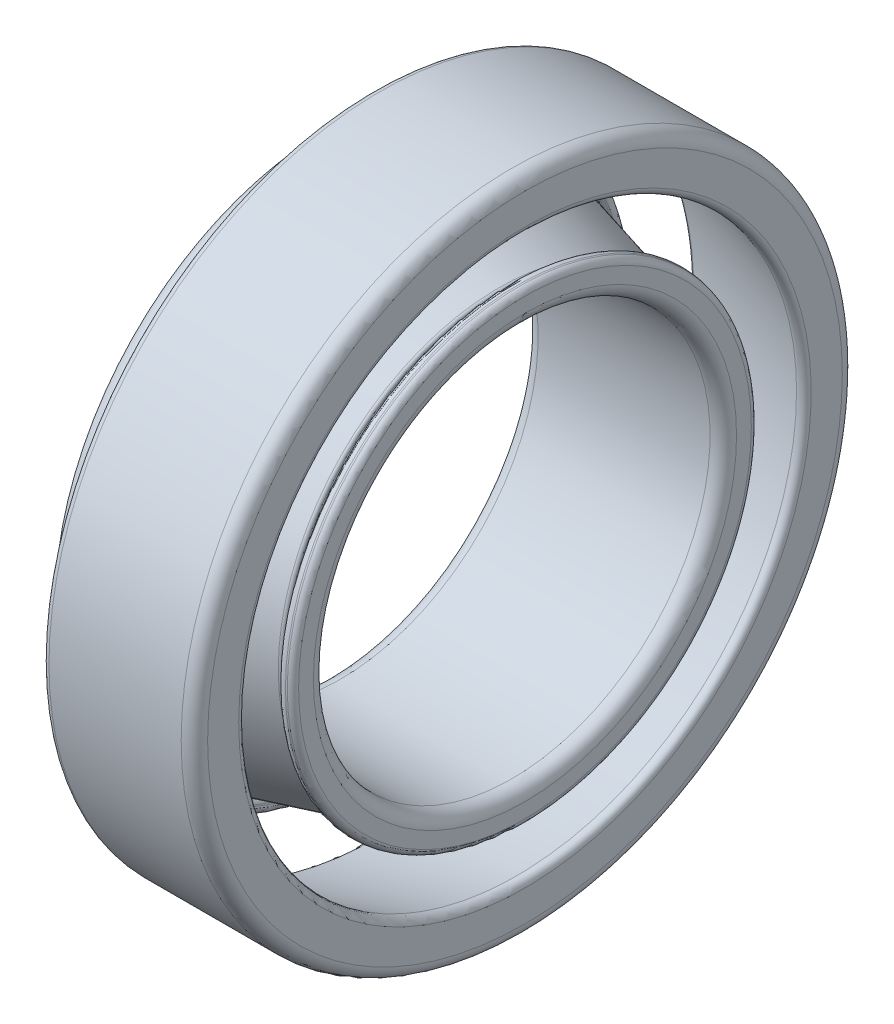
from build123d import *


with BuildPart() as part:
    # Sketch1 → Revolve1 (revolve)
    with BuildSketch(Plane.XY, mode=Mode.PRIVATE) as revolve1_sk:
        with BuildLine():
            Line((0, 48), (0, 43.298741099))
            ThreePointArc((0, 43.298741099), (-0.388542061, 42.507464163), (-1.252238377, 42.33107597))
            Line((-1.252238377, 42.33107597), (-22.252238377, 47.805083212))
            ThreePointArc((-22.252238377, 47.805083212), (-22.791276935, 48.161290402), (-23, 48.772748341))
            Line((-23, 48.772748341), (-23, 49))
            ThreePointArc((-23, 49), (-22.707106781, 49.707106781), (-22, 50))
            Line((-22, 50), (-2, 50))
            ThreePointArc((-2, 50), (-0.585786438, 49.414213562), (0, 48))
        make_face()
        with BuildLine():
            Line((-24.270316559, 38.65104355), (-3.959635187, 33.356718934))
            ThreePointArc((-3.959635187, 33.356718934), (-3.703437628, 33.195119057), (-3.587552929, 32.91525758))
            ThreePointArc((-3.587552929, 32.91525758), (-2.085266931, 32.137397959), (-2.030782372, 33.828243973))
            ThreePointArc((-2.030782372, 33.828243973), (-2.218461122, 34.066000985), (-2.234431104, 34.368485149))
            Line((-2.234431104, 34.368485149), (-2.187568634, 34.548264206))
            ThreePointArc((-2.187568634, 34.548264206), (-1.725786613, 35.15862787), (-0.967665129, 35.263690957))
            Line((-0.967665129, 35.263690957), (-0.747761623, 35.206369367))
            ThreePointArc((-0.747761623, 35.206369367), (-0.208723065, 34.850162178), (0, 34.238704239))
            Line((0, 34.238704239), (0, 32))
            ThreePointArc((0, 32), (-0.585786438, 30.585786438), (-2, 30))
            Line((-2, 30), (-28, 30))
            ThreePointArc((-28, 30), (-29.414213562, 30.585786438), (-30, 32))
            Line((-30, 32), (-30, 40.243298198))
            ThreePointArc((-30, 40.243298198), (-29.222915878, 41.825852069), (-27.495523246, 42.178628455))
            Line((-27.495523246, 42.178628455), (-25.950647056, 41.775930195))
            ThreePointArc((-25.950647056, 41.775930195), (-25.340283392, 41.314148174), (-25.235220304, 40.556026689))
            Line((-25.235220304, 40.556026689), (-25.282082774, 40.376247632))
            ThreePointArc((-25.282082774, 40.376247632), (-25.443682651, 40.120050074), (-25.723544128, 40.004165375))
            ThreePointArc((-25.723544128, 40.004165375), (-26.501403749, 38.501879376), (-24.810557735, 38.447394818))
            ThreePointArc((-24.810557735, 38.447394818), (-24.572800723, 38.635073567), (-24.270316559, 38.65104355))
        make_face()
    revolve(revolve1_sk.sketch.rotate(Axis((0, 0, 0), (1, 0, 0)), 90), axis=Axis((0, 0, 0), (1, 0, 0)))


solid = part.part
